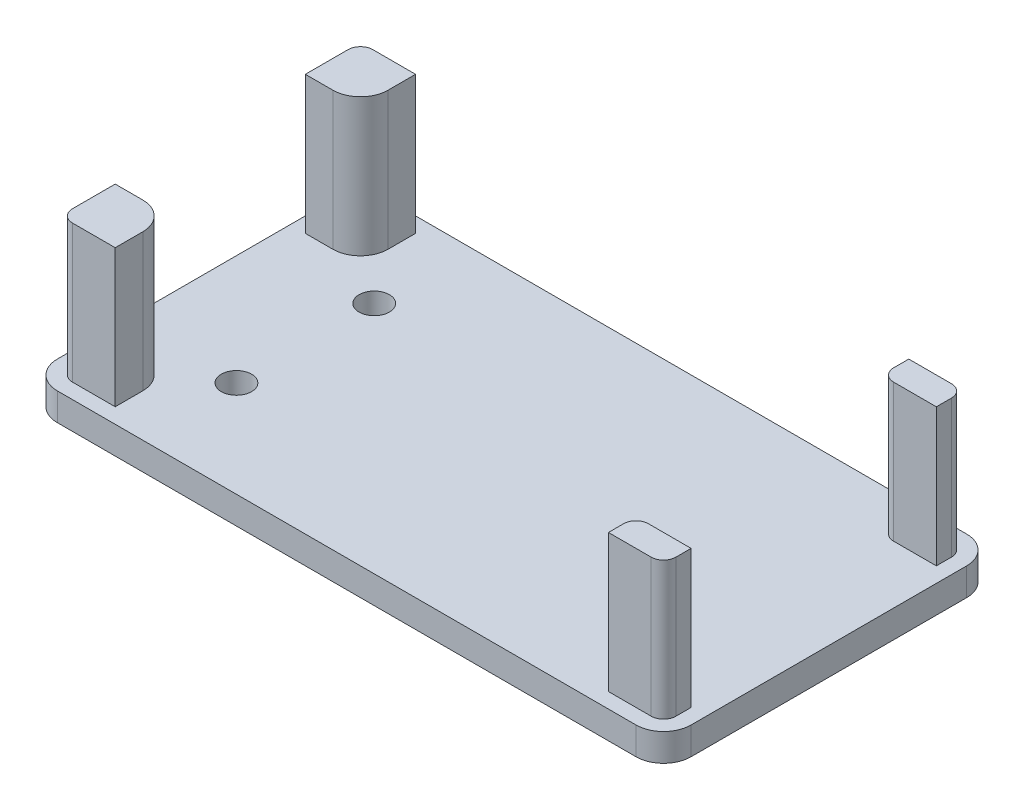
from build123d import *

# Parameters (mm, degrees)
SKETCH1_W           = 111.76
SKETCH1_H           = 60.96
BOSS_EXTRUDE1_DEPTH = 5.08
FILLET1_R           = 5.08
CUT_EXTRUDE1_REACH  = 129.406
SKETCH3_R           = 2.794
SKETCH3_R_2         = 3.302
SKETCH5_W           = 10.16
SKETCH5_H           = 60.96
BOSS_EXTRUDE2_DEPTH = 5.08
FILLET2_R           = 5.08
SKETCH2_W           = 10.16
SKETCH2_H           = 10.16
SKETCH2_H_2         = 5.08
BOSS_EXTRUDE5_DEPTH = 25.4
FILLET9_R           = 2.286
FILLET10_R          = 5.08
SKETCH6_R           = 6.996125679
BOSS_EXTRUDE6_DEPTH = 5.08


with BuildPart() as part:
    # Sketch1 → Boss-Extrude1 (new body)
    with BuildSketch(Plane(origin=(0, 0, 0), x_dir=(1, 0, 0), z_dir=(0, 1, 0))):
        with Locations((55.88, 30.48)):
            Rectangle(SKETCH1_W, SKETCH1_H)
    extrude(amount=BOSS_EXTRUDE1_DEPTH)

    # Fillet1
    fillet1_edges = [part.edges().sort_by_distance(p)[0] for p in [
        (0, 2.54, -60.96),
        (111.76, 2.54, -60.96),
        (111.76, 2.54, 0),
        (0, 2.54, 0),
    ]]
    fillet(fillet1_edges, radius=FILLET1_R)

    # Sketch3 → Cut-Extrude1 (cut, up to next)
    with BuildSketch(Plane.XZ, mode=Mode.PRIVATE) as cut_extrude1_sk1:
        with Locations(Location((20.32, -17.78, 0), (0, 0, 270))):
            Circle(SKETCH3_R)
    cut_extrude1_tool1 = extrude(cut_extrude1_sk1.sketch, amount=-CUT_EXTRUDE1_REACH, mode=Mode.PRIVATE) & part.part
    # Sketch3 → Cut-Extrude1 (cut, up to next)
    with BuildSketch(Plane.XZ, mode=Mode.PRIVATE) as cut_extrude1_sk2:
        with Locations(Location((20.32, -43.18, 0), (0, 0, 270))):
            Circle(SKETCH3_R)
    cut_extrude1_tool2 = extrude(cut_extrude1_sk2.sketch, amount=-CUT_EXTRUDE1_REACH, mode=Mode.PRIVATE) & part.part
    # Sketch3 → Cut-Extrude1 (cut, up to next)
    with BuildSketch(Plane.XZ, mode=Mode.PRIVATE) as cut_extrude1_sk3:
        with Locations(Location((30.48, -30.48, 0), (0, 0, 270))):
            Circle(SKETCH3_R_2)
    cut_extrude1_tool3 = extrude(cut_extrude1_sk3.sketch, amount=-CUT_EXTRUDE1_REACH, mode=Mode.PRIVATE) & part.part
    add(cut_extrude1_tool1.solids().sort_by_distance((20.32, 0, -17.78))[0], mode=Mode.SUBTRACT)
    add(cut_extrude1_tool2.solids().sort_by_distance((20.32, 0, -43.18))[0], mode=Mode.SUBTRACT)
    add(cut_extrude1_tool3.solids().sort_by_distance((30.48, 0, -30.48))[0], mode=Mode.SUBTRACT)

    # Sketch5 → Boss-Extrude2 (add)
    with BuildSketch(Plane.XZ):
        with Locations((111.76, -30.48)):
            Rectangle(SKETCH5_W, SKETCH5_H)
    extrude(amount=-BOSS_EXTRUDE2_DEPTH)

    # Fillet2
    fillet2_edges = [part.edges().sort_by_distance(p)[0] for p in [
        (116.84, 2.54, 0),
        (116.84, 2.54, -60.96),
    ]]
    fillet(fillet2_edges, radius=FILLET2_R)

    # Sketch2 → Boss-Extrude5 (add)
    with BuildSketch(Plane(origin=(0, 5.08, 0), x_dir=(1, 0, 0), z_dir=(0, 1, 0))):
        with Locations((7.874, 53.086)):
            Rectangle(SKETCH2_W, SKETCH2_H)
        with Locations((7.874, 7.874)):
            Rectangle(SKETCH2_W, SKETCH2_H)
        with Locations((108.966, 55.626)):
            Rectangle(SKETCH2_W, SKETCH2_H_2)
        with Locations((108.966, 5.334)):
            Rectangle(SKETCH2_W, SKETCH2_H_2)
    extrude(amount=BOSS_EXTRUDE5_DEPTH)

    # Fillet9
    fillet9_edges = [part.edges().sort_by_distance(p)[0] for p in [
        (103.886, 17.78, -7.874),
        (114.046, 17.78, -2.794),
        (2.794, 17.78, -2.794),
        (2.794, 17.78, -58.166),
        (103.886, 17.78, -53.086),
        (114.046, 17.78, -58.166),
    ]]
    fillet(fillet9_edges, radius=FILLET9_R)

    # Fillet10
    fillet10_edges = [part.edges().sort_by_distance(p)[0] for p in [
        (12.954, 17.78, -12.954),
        (12.954, 17.78, -48.006),
    ]]
    fillet(fillet10_edges, radius=FILLET10_R)

    # Sketch6 → Boss-Extrude6 (add)
    with BuildSketch(Plane(origin=(0, 5.08, 0), x_dir=(1, 0, 0), z_dir=(0, 1, 0))):
        with Locations((30.48, 30.48)):
            Circle(SKETCH6_R)
    extrude(amount=-BOSS_EXTRUDE6_DEPTH)


solid = part.part
